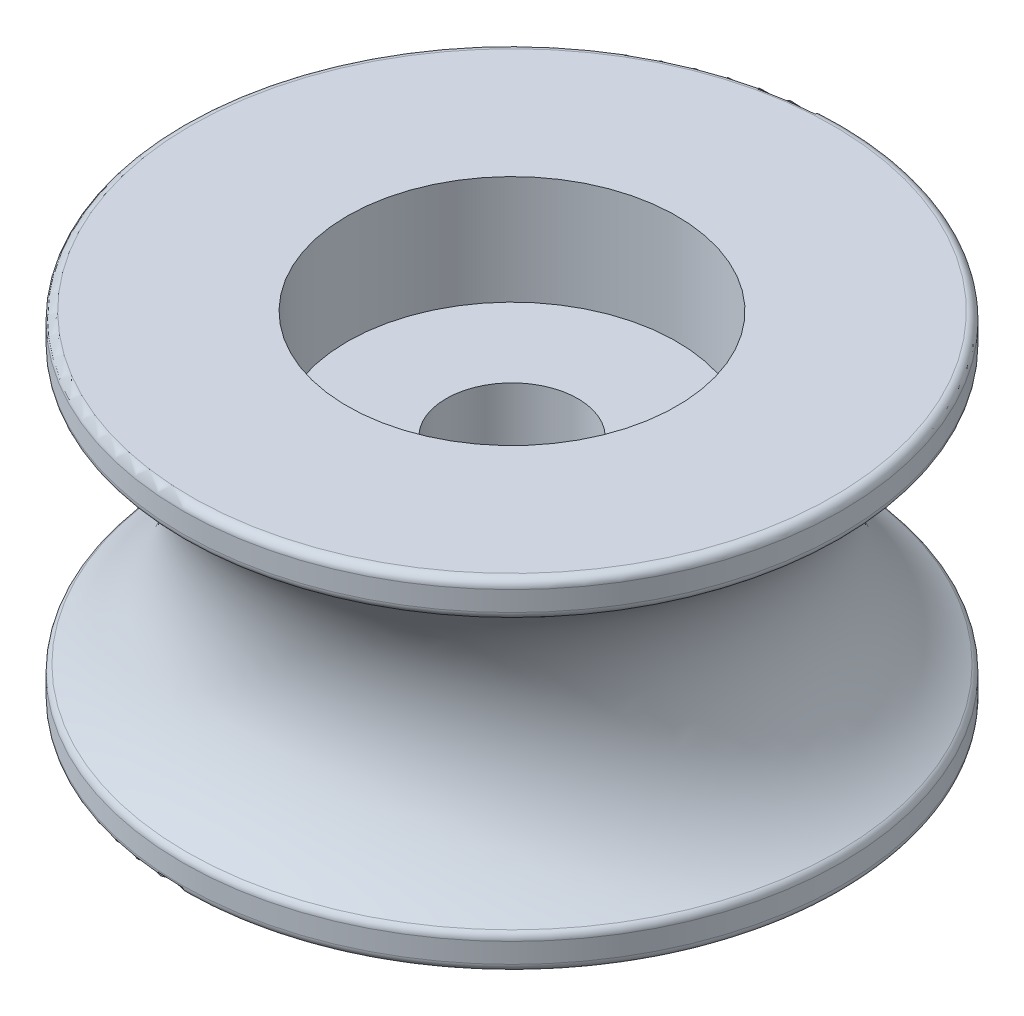
from build123d import *

# Parameters (mm, degrees)
RACCORDO1_R = 0.5


with BuildPart() as part:
    # Schizzo5 → Rivoluzione12 (revolve)
    with BuildSketch(Plane.XY, mode=Mode.PRIVATE) as rivoluzione12_sk:
        with BuildLine():
            Line((20, 10.35), (20, 8.35))
            ThreePointArc((20, 8.35), (14.99677569, 0), (20, -8.35))
            Line((20, -8.35), (20, -10.35))
            Line((20, -10.35), (10, -10.35))
            Line((10, -10.35), (10, -3.75))
            Line((10, -3.75), (4, -3.75))
            Line((4, -3.75), (4, 3.75))
            Line((4, 3.75), (10, 3.75))
            Line((10, 3.75), (10, 10.35))
            Line((10, 10.35), (20, 10.35))
        make_face()
    revolve(rivoluzione12_sk.sketch.rotate(Axis((0, 10.35, 0), (0, -1, 0)), 180), axis=Axis((0, 10.35, 0), (0, -1, 0)))

    # Raccordo1
    raccordo1_edges = [part.edges().sort_by_distance(p)[0] for p in [
        (20, 10.35, 0),
        (20, 8.35, 0),
        (20, -8.35, 0),
        (20, -10.35, 0),
    ]]
    fillet(raccordo1_edges, radius=RACCORDO1_R)


solid = part.part
